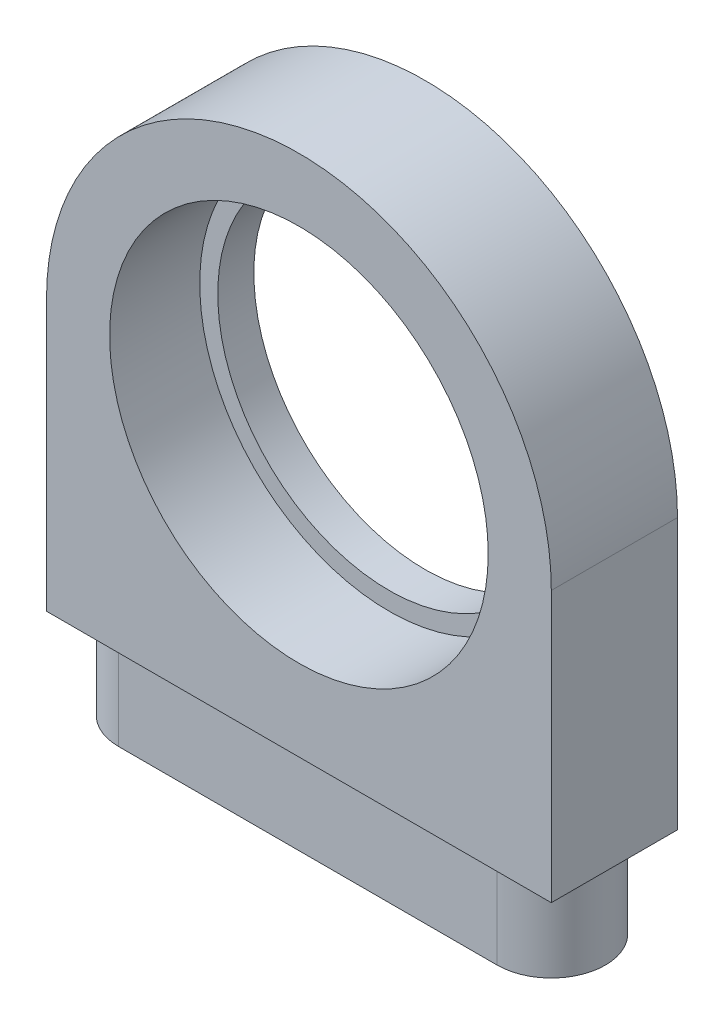
from build123d import *

# Parameters (mm, degrees)
BOSS_EXTRUDE1_DEPTH = 5
SKETCH2_W           = 28
SKETCH2_H           = 7
BOSS_EXTRUDE2_DEPTH = 29
CUT_EXTRUDE1_DEPTH  = 7
SKETCH4_R           = 10.5
CUT_EXTRUDE2_DEPTH  = 5
SKETCH5_R           = 9.5
CUT_EXTRUDE3_DEPTH  = 2


with BuildPart() as part:
    # Sketch1 → Boss-Extrude1 (new body)
    with BuildSketch(Plane(origin=(0, 0, 0), x_dir=(1, 0, 0), z_dir=(0, 1, 0))):
        with BuildLine():
            Line((-10.5, 3), (10.5, 3))
            ThreePointArc((10.5, 3), (13.5, 0), (10.5, -3))
            Line((10.5, -3), (-10.5, -3))
            ThreePointArc((-10.5, -3), (-13.5, 0), (-10.5, 3))
        make_face()
    extrude(amount=-BOSS_EXTRUDE1_DEPTH)

    # Sketch2 → Boss-Extrude2 (add)
    with BuildSketch(Plane(origin=(0, 0, 0), x_dir=(1, 0, 0), z_dir=(0, 1, 0))):
        Rectangle(SKETCH2_W, SKETCH2_H)
    extrude(amount=BOSS_EXTRUDE2_DEPTH)

    # Sketch3 → Cut-Extrude1 (cut)
    with BuildSketch(Plane.XY.offset(3.5)):
        with BuildLine():
            Line((-14, 15), (-14, 33.512664493))
            Line((-14, 33.512664493), (14, 33.512664493))
            Line((14, 33.512664493), (14, 15))
            ThreePointArc((14, 15), (0, 29), (-14, 15))
        make_face()
    extrude(amount=-CUT_EXTRUDE1_DEPTH, mode=Mode.SUBTRACT)

    # Sketch4 → Cut-Extrude2 (cut)
    with BuildSketch(Plane.XY.offset(3.5)):
        with Locations((0, 15)):
            Circle(SKETCH4_R)
    extrude(amount=-CUT_EXTRUDE2_DEPTH, mode=Mode.SUBTRACT)

    # Sketch5 → Cut-Extrude3 (cut)
    with BuildSketch(Plane.XY.offset(-1.5)):
        with Locations((0, 15)):
            Circle(SKETCH5_R)
    extrude(amount=-CUT_EXTRUDE3_DEPTH, mode=Mode.SUBTRACT)


solid = part.part
